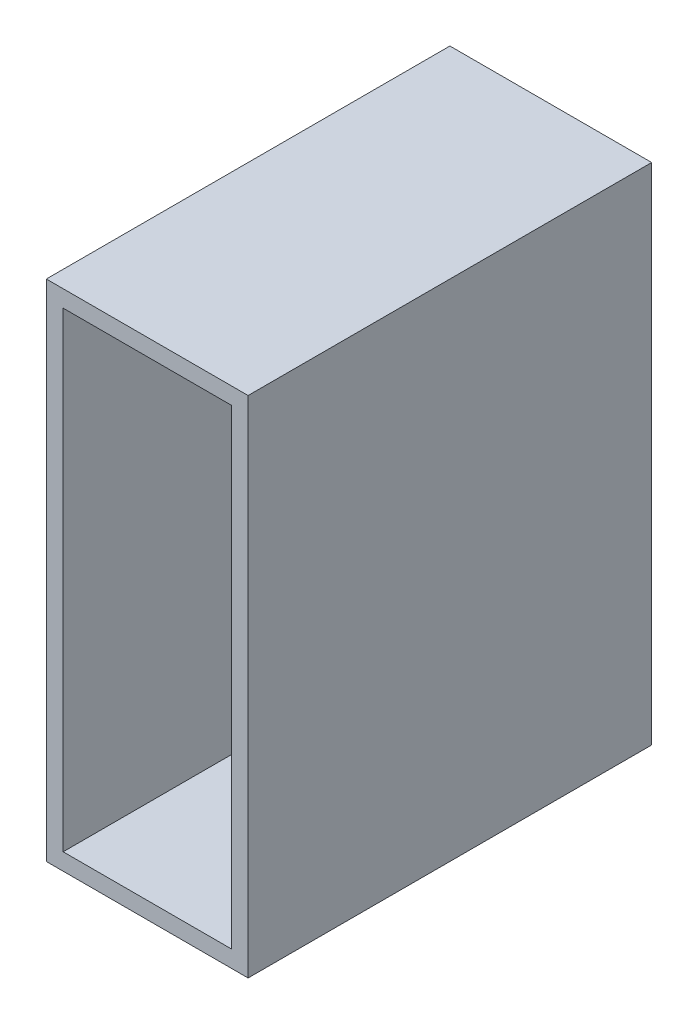
from build123d import *

# Parameters (mm, degrees)
SKETCH1_W     = 24
SKETCH1_H     = 60
SKETCH1_W_2   = 20
SKETCH1_H_2   = 56
PROFILE_DEPTH = 48
SKETCH2_W     = 20
SKETCH2_H     = 56
BACK_DEPTH    = 2


with BuildPart() as part:
    # Sketch1 → Profile (new body)
    with BuildSketch(Plane.XY):
        with Locations((12, 30)):
            Rectangle(SKETCH1_W, SKETCH1_H)
        with Locations((12, 30)):
            Rectangle(SKETCH1_W_2, SKETCH1_H_2, mode=Mode.SUBTRACT)
    extrude(amount=PROFILE_DEPTH)

    # Sketch2 → Back (add)
    with BuildSketch(Plane.XY):
        with Locations((12, 30)):
            Rectangle(SKETCH2_W, SKETCH2_H)
    extrude(amount=BACK_DEPTH)


solid = part.part
